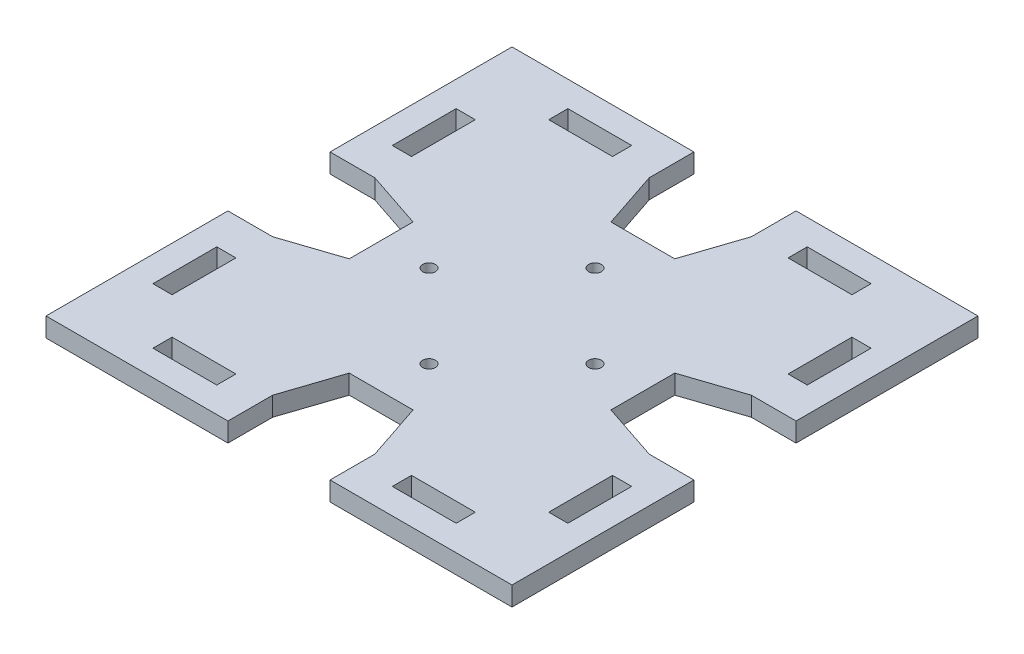
from build123d import *

# Parameters (mm, degrees)
SKETCH1_R           = 1
SKETCH1_W           = 3
SKETCH1_H           = 10
SKETCH1_W_2         = 10
SKETCH1_H_2         = 3
BOSS_EXTRUDE1_DEPTH = 3


with BuildPart() as part:
    # Sketch1 → Boss-Extrude1 (new body)
    with BuildSketch(Plane(origin=(0, 0, 0), x_dir=(1, 0, 0), z_dir=(0, 1, 0))):
        Polygon((-31.5, 9), (-41.5, 9), (-44.5, 0), (-44.5, -7), (-73, -7), (-73, 21.5), (-66, 21.5), (-57, 24.5), (-57, 34.5), (-66, 37.5), (-73, 37.5), (-73, 66), (-44.5, 66), (-44.5, 59), (-41.5, 50), (-31.5, 50), (-28.5, 59), (-28.5, 66), (0, 66), (0, 37.5), (-7, 37.5), (-16, 34.5), (-16, 24.5), (-7, 21.5), (0, 21.5), (0, -7), (-28.5, -7), (-28.5, 0), align=None)
        with Locations(Location((-36.5, 42.5, 0), (0, 0, 270))):
            Circle(SKETCH1_R, mode=Mode.SUBTRACT)
        with Locations(Location((-23.5, 29.5, 0), (0, 0, 270))):
            Circle(SKETCH1_R, mode=Mode.SUBTRACT)
        with Locations(Location((-36.5, 16.5, 0), (0, 0, 270))):
            Circle(SKETCH1_R, mode=Mode.SUBTRACT)
        with Locations(Location((-49.5, 29.5, 0), (0, 0, 270))):
            Circle(SKETCH1_R, mode=Mode.SUBTRACT)
        with Locations((-5.5, 48.25)):
            Rectangle(SKETCH1_W, SKETCH1_H, mode=Mode.SUBTRACT)
        with Locations((-5.5, 10.75)):
            Rectangle(SKETCH1_W, SKETCH1_H, mode=Mode.SUBTRACT)
        with Locations((-67.5, 10.75)):
            Rectangle(SKETCH1_W, SKETCH1_H, mode=Mode.SUBTRACT)
        with Locations((-67.5, 48.25)):
            Rectangle(SKETCH1_W, SKETCH1_H, mode=Mode.SUBTRACT)
        with Locations((-55.25, -1.5)):
            Rectangle(SKETCH1_W_2, SKETCH1_H_2, mode=Mode.SUBTRACT)
        with Locations((-17.75, -1.5)):
            Rectangle(SKETCH1_W_2, SKETCH1_H_2, mode=Mode.SUBTRACT)
        with Locations((-17.75, 60.5)):
            Rectangle(SKETCH1_W_2, SKETCH1_H_2, mode=Mode.SUBTRACT)
        with Locations((-55.25, 60.5)):
            Rectangle(SKETCH1_W_2, SKETCH1_H_2, mode=Mode.SUBTRACT)
    extrude(amount=BOSS_EXTRUDE1_DEPTH)


solid = part.part
